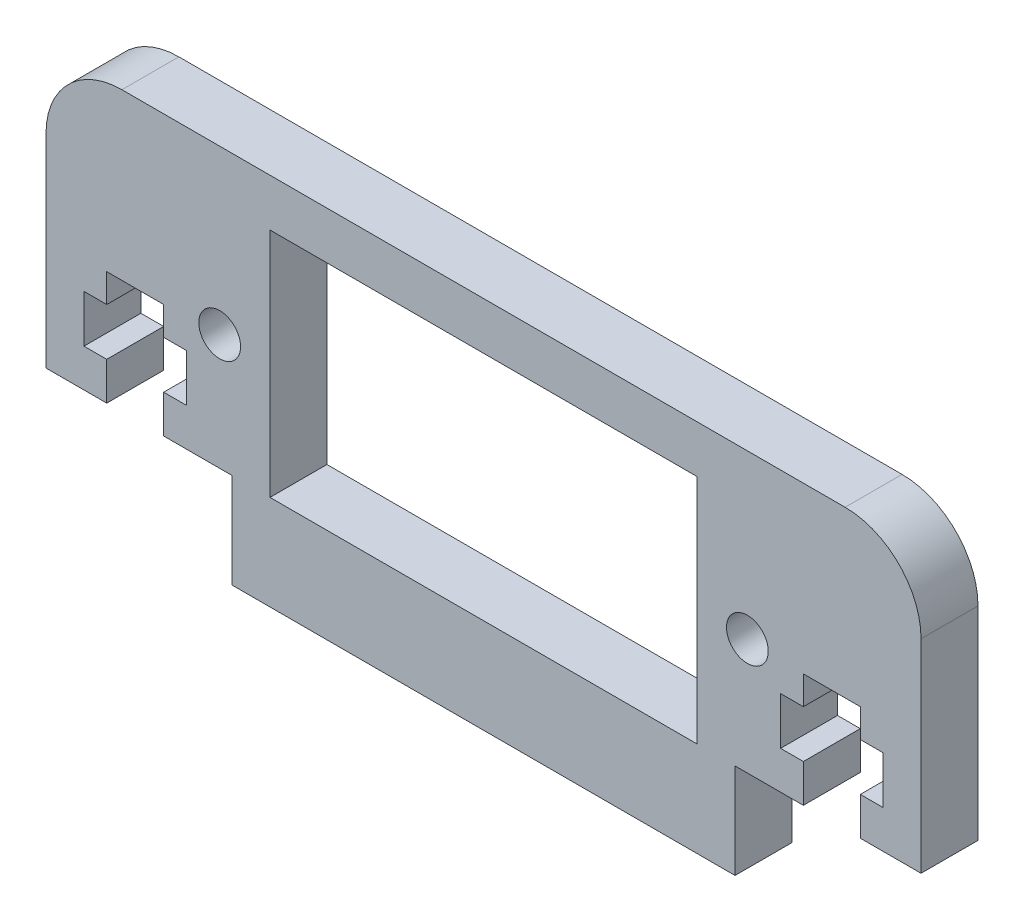
from build123d import *

# Parameters (mm, degrees)
SKETCH1_R               = 1.1
BOSS_EXTRUDE1_DEPTH     = 3
FILLET1_R               = 4
CUT_EXTRUDE1_DEPTH      = 10
CUT_EXTRUDE1_DEPTH_BACK = 25.78431964
SKETCH3_W               = 26.5
SKETCH3_H               = 5
BOSS_EXTRUDE2_DEPTH     = 3


with BuildPart() as part:
    # Sketch1 → Boss-Extrude1 (new body)
    with BuildSketch(Plane.XY):
        Polygon((-23.05, 8.6), (-23.05, -6.1), (-11.25, -6.1), (-11.25, 6.1), (11.25, 6.1), (11.25, -6.1), (23.05, -6.1), (23.05, 8.6), align=None)
        with Locations((-13.9, 0)):
            Circle(SKETCH1_R, mode=Mode.SUBTRACT)
        with Locations((13.9, 0)):
            Circle(SKETCH1_R, mode=Mode.SUBTRACT)
    extrude(amount=BOSS_EXTRUDE1_DEPTH)

    # Fillet1
    fillet1_edges = [part.edges().sort_by_distance(p)[0] for p in [
        (-23.05, 8.6, 1.5),
        (23.05, 8.6, 1.5),
    ]]
    fillet(fillet1_edges, radius=FILLET1_R)

    # Sketch2 → Cut-Extrude1 (cut, two sides: drawn at the far end of the back side and taken through both)
    with BuildSketch(Plane(origin=(0, 0, 0), x_dir=(-1, 0, 0), z_dir=(0, 0, -1)).offset(-CUT_EXTRUDE1_DEPTH_BACK)):
        Polygon((-16.85, -0.1), (-19.85, -0.1), (-19.85, -1.6), (-21.05, -1.6), (-21.05, -4.1), (-19.85, -4.1), (-19.85, -6.1), (-16.85, -6.1), (-16.85, -4.1), (-15.65, -4.1), (-15.65, -1.6), (-16.85, -1.6), align=None)
        Polygon((19.85, -4.1), (21.05, -4.1), (21.05, -1.6), (19.85, -1.6), (19.85, -0.1), (16.85, -0.1), (16.85, -1.6), (15.65, -1.6), (15.65, -4.1), (16.85, -4.1), (16.85, -6.1), (19.85, -6.1), align=None)
    extrude(amount=CUT_EXTRUDE1_DEPTH + CUT_EXTRUDE1_DEPTH_BACK, mode=Mode.SUBTRACT)

    # Sketch3 → Boss-Extrude2 (add)
    with BuildSketch(Plane(origin=(0, 0, 0), x_dir=(-1, 0, 0), z_dir=(0, 0, -1))):
        with Locations((0, -8.6)):
            Rectangle(SKETCH3_W, SKETCH3_H)
    extrude(amount=-BOSS_EXTRUDE2_DEPTH)


solid = part.part
